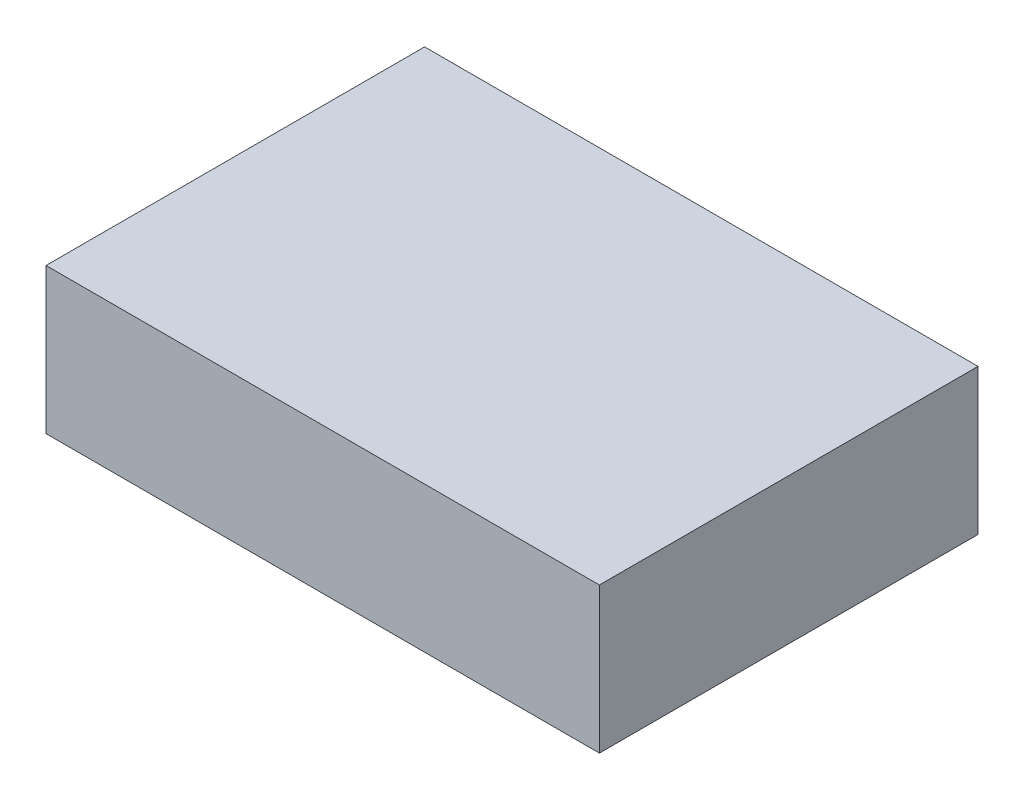
from build123d import *

# Parameters (mm, degrees)
SKETCH1_W           = 60.325
SKETCH1_H           = 41.275
BOSS_EXTRUDE1_DEPTH = 15.875


with BuildPart() as part:
    # Sketch1 → Boss-Extrude1 (new body)
    with BuildSketch(Plane(origin=(0, 0, 0), x_dir=(1, 0, 0), z_dir=(0, 1, 0))):
        Rectangle(SKETCH1_W, SKETCH1_H)
    extrude(amount=BOSS_EXTRUDE1_DEPTH)


solid = part.part
